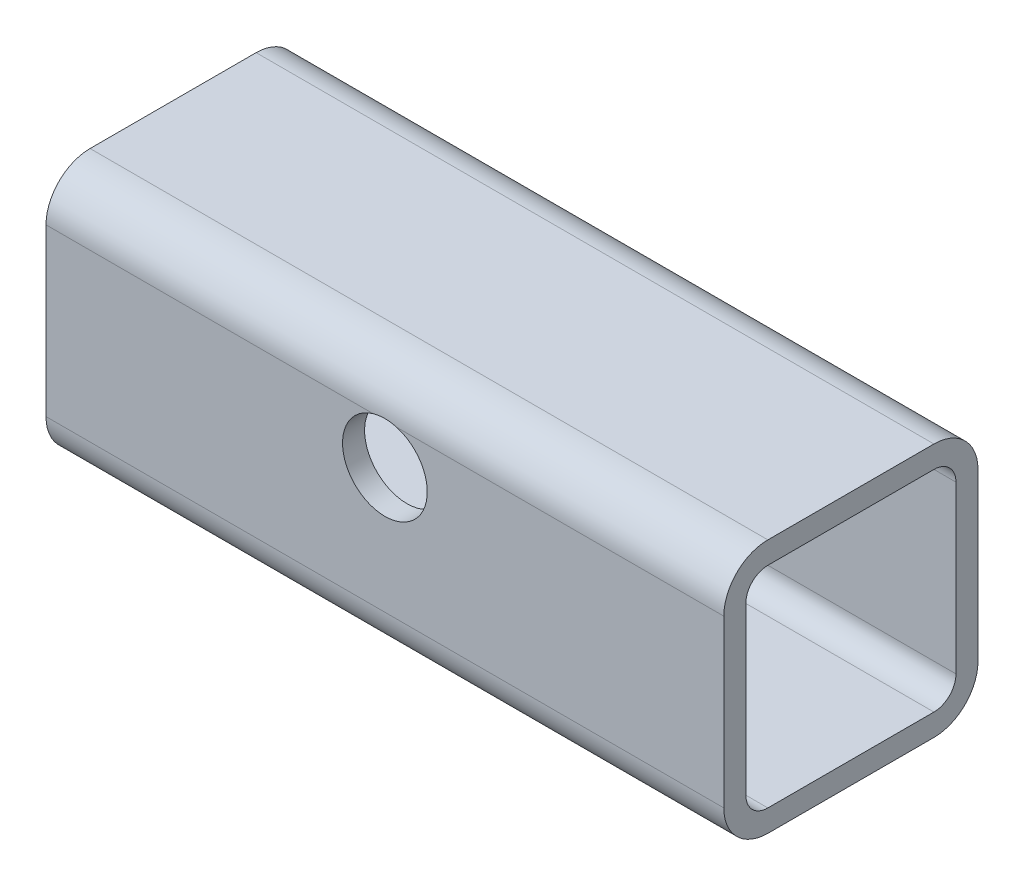
from build123d import *

# Parameters (mm, degrees)
RURA_KWADRATOWA_30_X_30_X_2_6_1_DEPTH = 80
SZKIC3_R                              = 5
WYTNIJ_WYCI_GNI_CIE1_DEPTH            = 87.746757864


with BuildPart() as part:
    # Sketch11 → Rura kwadratowa 30 X 30 X 2.6(1) (new body)
    with BuildSketch(Plane(origin=(0, 0, 0), x_dir=(0, 0, -1), z_dir=(1, 0, 0))):
        with BuildLine():
            Line((-9.8, -15), (9.8, -15))
            ThreePointArc((9.8, -15), (13.476955262, -13.476955262), (15, -9.8))
            Line((15, -9.8), (15, 9.8))
            ThreePointArc((15, 9.8), (13.476955262, 13.476955262), (9.8, 15))
            Line((9.8, 15), (-9.8, 15))
            ThreePointArc((-9.8, 15), (-13.476955262, 13.476955262), (-15, 9.8))
            Line((-15, 9.8), (-15, -9.8))
            ThreePointArc((-15, -9.8), (-13.476955262, -13.476955262), (-9.8, -15))
        make_face()
        with BuildLine():
            Line((-9.8, -12.4), (9.8, -12.4))
            ThreePointArc((9.8, -12.4), (11.638477631, -11.638477631), (12.4, -9.8))
            Line((12.4, -9.8), (12.4, 9.8))
            ThreePointArc((12.4, 9.8), (11.638477631, 11.638477631), (9.8, 12.4))
            Line((9.8, 12.4), (-9.8, 12.4))
            ThreePointArc((-9.8, 12.4), (-11.638477631, 11.638477631), (-12.4, 9.8))
            Line((-12.4, 9.8), (-12.4, -9.8))
            ThreePointArc((-12.4, -9.8), (-11.638477631, -11.638477631), (-9.8, -12.4))
        make_face(mode=Mode.SUBTRACT)
    extrude(amount=RURA_KWADRATOWA_30_X_30_X_2_6_1_DEPTH)

    # Szkic3 → Wytnij-wyciągnięcie1 (cut, through all)
    with BuildSketch(Plane.XY.offset(15)):
        with Locations(Location((40, 5, 0), (0, 0, 73.739795292))):
            Circle(SZKIC3_R)
    extrude(amount=-WYTNIJ_WYCI_GNI_CIE1_DEPTH, mode=Mode.SUBTRACT)


solid = part.part
